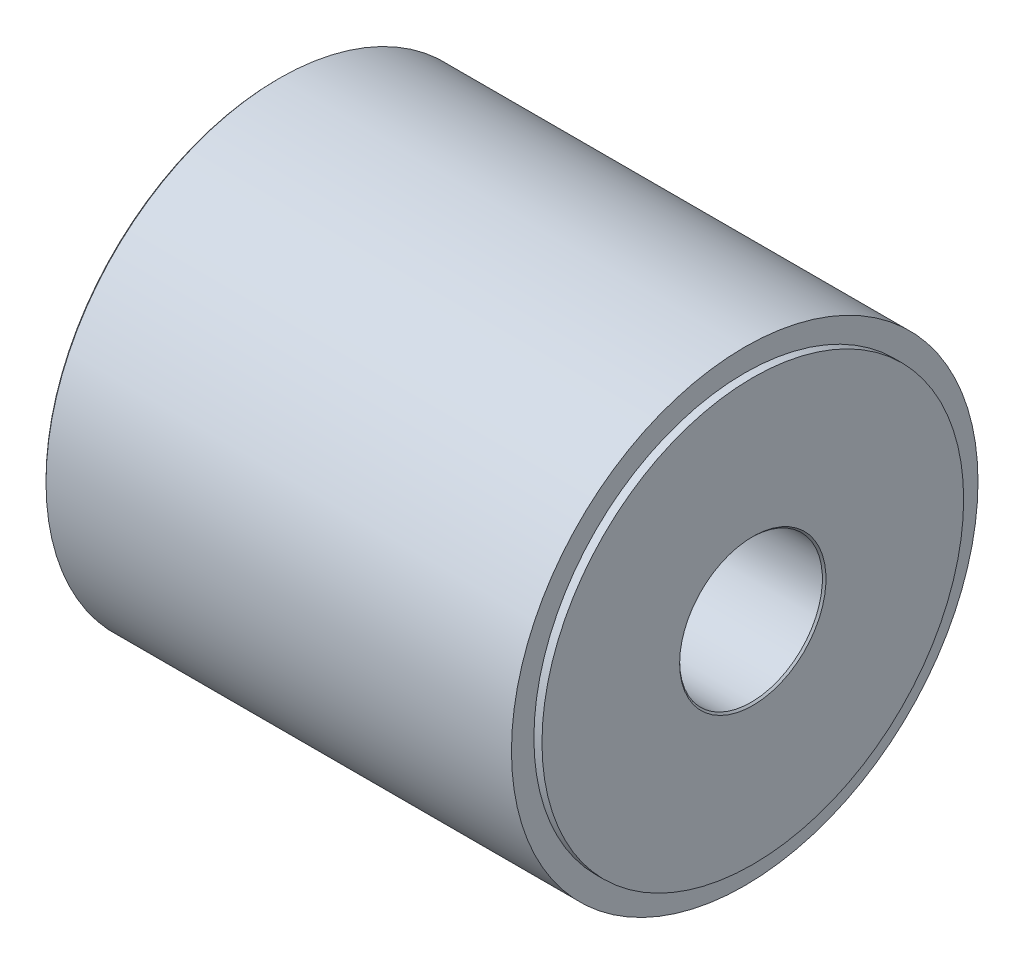
from build123d import *

# Parameters (mm, degrees)
CHAMFER1_SIZE = 0.2


with BuildPart() as part:
    # Sketch1 → Revolve1 (revolve)
    with BuildSketch(Plane.XY, mode=Mode.PRIVATE) as revolve1_sk:
        Polygon((0, 23.5), (1, 23.5), (1, 26), (53.08, 26), (53.08, 23.5), (53.98, 23.5), (53.98, 7.9565), (0, 7.9565), align=None)
    revolve(revolve1_sk.sketch.rotate(Axis((0, 0, 0), (1, 0, 0)), 90), axis=Axis((0, 0, 0), (1, 0, 0)))

    # Chamfer1
    chamfer1_edges = [part.edges().sort_by_distance(p)[0] for p in [
        (0, 0, -23.5),
        (0, 0, -7.9565),
        (53.98, 0, -7.9565),
        (1, 0, -26),
    ]]
    chamfer(chamfer1_edges, length=CHAMFER1_SIZE)


solid = part.part
